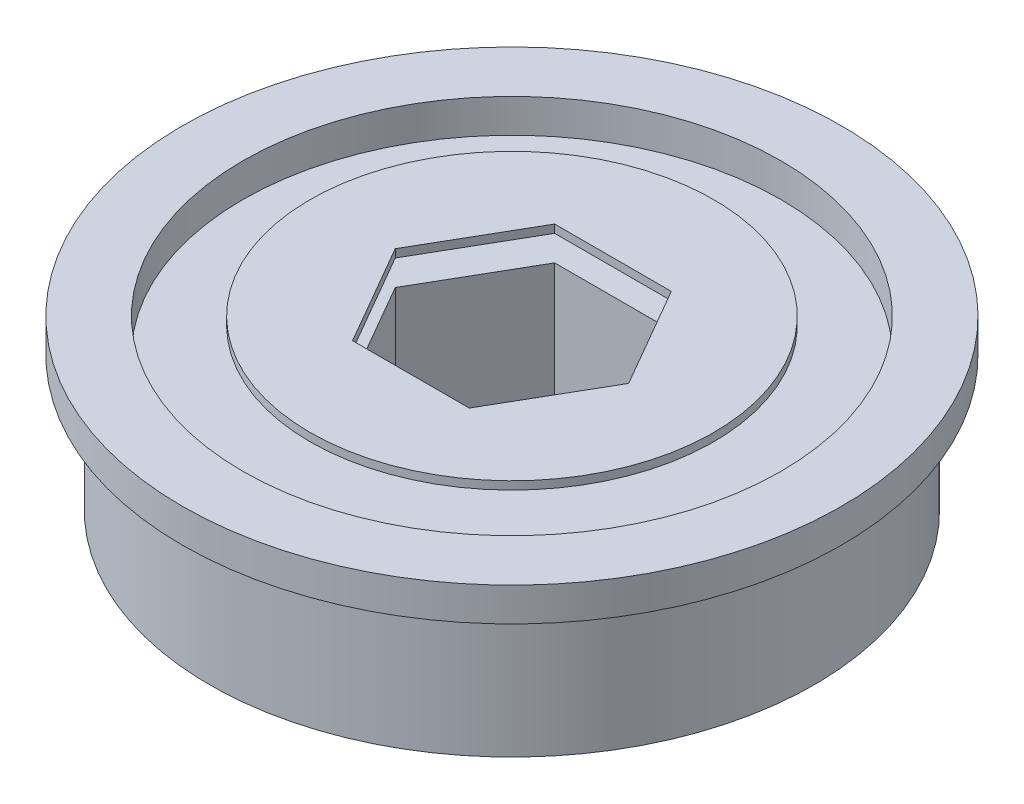
from build123d import *

# Parameters (mm, degrees)
SKETCH1_W             = 15.5575
SKETCH1_H             = 1.5875
M22_CLEARANCE_HOLE1_D = 25.4
SKETCH4_R             = 9.525
BOSS_EXTRUDE1_DEPTH   = 0.381
SKETCH5_R             = 14.2748
BOSS_EXTRUDE2_DEPTH   = 6.35
CUT_EXTRUDE1_DEPTH    = 24.389645546


with BuildPart() as part:
    # Sketch1 → Revolve1 (revolve)
    with BuildSketch(Plane(origin=(0, 0, 0), x_dir=(-1, 0, 0), z_dir=(0, 0, -1)), mode=Mode.PRIVATE) as revolve1_sk:
        with Locations((-7.77875, 7.14375)):
            Rectangle(SKETCH1_W, SKETCH1_H)
    revolve(revolve1_sk.sketch.rotate(Axis((0, 6.35, 0), (0, 1, 0)), 270), axis=Axis((0, 6.35, 0), (0, 1, 0)))

    # M22 Clearance Hole1 (through all)
    with Locations(Plane(origin=(0, 7.9375, 0), x_dir=(1, 0, 0), z_dir=(0, 1, 0))):
        with Locations((0, 0)):
            Hole(M22_CLEARANCE_HOLE1_D / 2)

    # Sketch5 → Boss-Extrude2 (add)
    with BuildSketch(Plane.XZ.offset(-6.35)):
        with Locations(Location((0, 0, 0), (0, 0, 270))):
            Circle(SKETCH5_R)
    extrude(amount=BOSS_EXTRUDE2_DEPTH)


with BuildPart() as body_2:
    # Sketch4 → Boss-Extrude1 (new body)
    with BuildSketch(Plane.XZ.offset(-7.5565)):
        with Locations(Location((0, 0, 0), (0, 0, 90))):
            Circle(SKETCH4_R)
    extrude(amount=-BOSS_EXTRUDE1_DEPTH)


with BuildPart() as cut_extrude1_tool:
    # Sketch6 → Cut-Extrude1 (new, through all)
    with BuildSketch(Plane.XZ):
        Polygon((-5.507921568, 0), (-2.753960784, -4.77), (2.753960784, -4.77), (5.507921568, 0), (2.753960784, 4.77), (-2.753960784, 4.77), align=None)
    extrude(amount=-CUT_EXTRUDE1_DEPTH)


with BuildPart() as part_1:
    add(part.part)

    # Cut-Extrude1: cut by cut_extrude1_tool
    add(cut_extrude1_tool.part, mode=Mode.SUBTRACT)


with BuildPart() as body_2_1:
    add(body_2.part)

    # Cut-Extrude1: cut by cut_extrude1_tool
    add(cut_extrude1_tool.part, mode=Mode.SUBTRACT)


solid = Compound([part_1.part, body_2_1.part])
